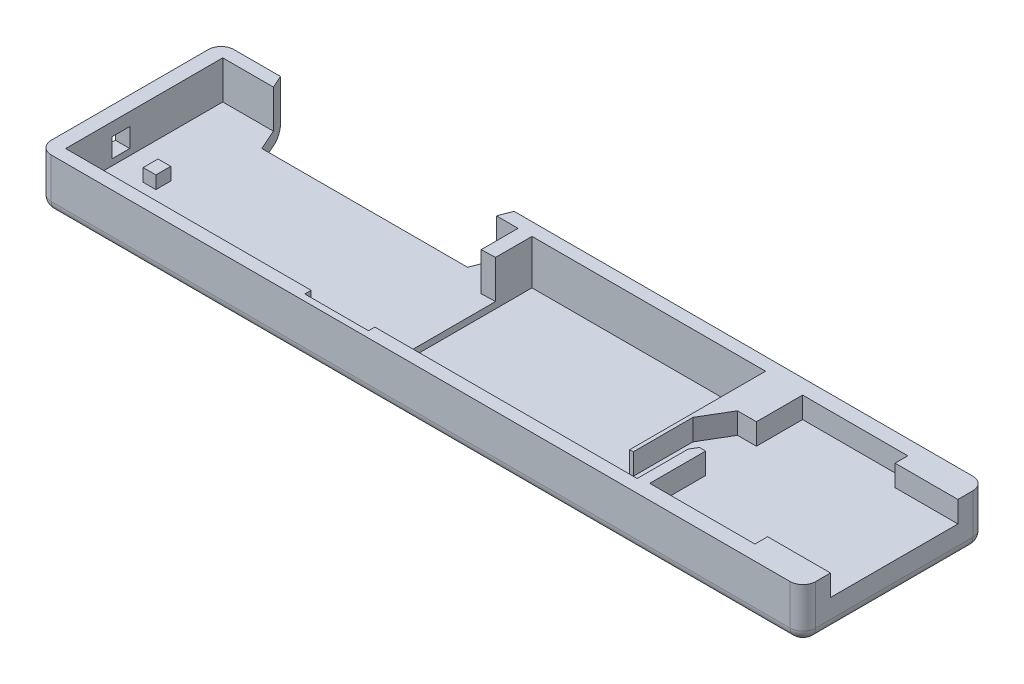
from build123d import *

# Parameters (mm, degrees)
SKETCH_3_W           = 180
SKETCH_3_H           = 43
EXTRUDE_1_DEPTH      = 12
CUT_EXTRUDE_1_DEPTH  = 52
CUT_EXTRUDE_2_DEPTH  = 5
CUT_EXTRUDE_3_DEPTH  = 5
SKETCH_8_W           = 55
SKETCH_8_H           = 37
CUT_EXTRUDE_4_DEPTH  = 10.5
CUT_EXTRUDE_5_DEPTH  = 5
SKETCH_10_W          = 62.128790526
SKETCH_10_H          = 8.683746703
CUT_EXTRUDE_6_DEPTH  = 8
CUT_EXTRUDE_8_DEPTH  = 9
FILLET_3_R           = 3
FILLET_4_R           = 2.5
SKETCH_12_W          = 15
SKETCH_12_H          = 1.5
CUT_EXTRUDE_9_DEPTH  = 5.5
SKETCH_14_W          = 4.2
SKETCH_14_H          = 4.5
CUT_EXTRUDE_10_DEPTH = 5.5
SKETCH_15_W          = 3
SKETCH_15_H          = 3.5
EXTRUDE_2_DEPTH      = 3


with BuildPart() as part:
    # 草图3 → 凸台-拉伸1 (new body)
    with BuildSketch(Plane(origin=(0, 0, 0), x_dir=(1, 0, 0), z_dir=(0, 1, 0))):
        with Locations((50.068597249, 7.753123643)):
            Rectangle(SKETCH_3_W, SKETCH_3_H)
    extrude(amount=EXTRUDE_1_DEPTH)

    # 草图4 → 切除-拉伸1 (cut)
    with BuildSketch(Plane(origin=(0, 0, 0), x_dir=(1, 0, 0), z_dir=(0, 1, 0))):
        Polygon((-22.469613434, -5.858946979), (26.002261286, -5.858946979), (29.068597249, -13.746876357), (-25.931402751, -13.746876357), align=None)
    extrude(amount=CUT_EXTRUDE_1_DEPTH, mode=Mode.SUBTRACT)

    # 草图5 → 切除-拉伸2 (cut)
    with BuildSketch(Plane(origin=(0, 12, 0), x_dir=(1, 0, 0), z_dir=(0, 1, 0))):
        Polygon((140.068597249, 7.753123643), (140.068597249, 22.753123643), (125.276479966, 22.753123643), (125.276479966, -7.246876357), (140.068597249, -7.246876357), align=None)
    extrude(amount=-CUT_EXTRUDE_2_DEPTH, mode=Mode.SUBTRACT)

    # 草图7 → 切除-拉伸3 (cut)
    with BuildSketch(Plane(origin=(0, 12, 0), x_dir=(1, 0, 0), z_dir=(0, 1, 0))):
        Polygon((125.276479966, 7.753123643), (125.276479966, 25.753123643), (100.500825538, 25.753123643), (100.500825538, -10.246876357), (125.276479966, -10.246876357), align=None)
    extrude(amount=-CUT_EXTRUDE_3_DEPTH, mode=Mode.SUBTRACT)

    # 草图8 → 切除-拉伸4 (cut)
    with BuildSketch(Plane(origin=(0, 12, 0), x_dir=(1, 0, 0), z_dir=(0, 1, 0))):
        with Locations((63.776287419, 7.753123643)):
            Rectangle(SKETCH_8_W, SKETCH_8_H)
    extrude(amount=-CUT_EXTRUDE_4_DEPTH, mode=Mode.SUBTRACT)

    # 草图9 → 切除-拉伸5 (cut)
    with BuildSketch(Plane(origin=(0, 12, 0), x_dir=(1, 0, 0), z_dir=(0, 1, 0))):
        Polygon((91.276287419, 26.253123643), (98.039619719, 26.253123643), (98.039619719, 22.130591531), (98.039619719, 14.279735666), (99.048577369, 12.579380219), (100.500825538, 12.579380219), (100.500825538, 0.629591822), (96.047349228, 0.629591822), (92.132656028, 7.226865659), (92.132656028, 21.255120764), (91.276287419, 21.255120764), align=None)
    extrude(amount=-CUT_EXTRUDE_5_DEPTH, mode=Mode.SUBTRACT)

    # 草图10 → 切除-拉伸6 (cut)
    with BuildSketch(Plane(origin=(0, 12, 0), x_dir=(1, 0, 0), z_dir=(0, 1, 0))):
        with Locations((1.934159822, -6.405003006)):
            Rectangle(SKETCH_10_W, SKETCH_10_H)
    extrude(amount=-CUT_EXTRUDE_6_DEPTH, mode=Mode.SUBTRACT)

    # 草图11 → 切除-拉伸8 (cut)
    with BuildSketch(Plane(origin=(0, 12, 0), x_dir=(1, 0, 0), z_dir=(0, 1, 0))):
        Polygon((32.998555085, -10.746876357), (-36.5396752, -10.746876357), (-36.5396752, 26.253123643), (36.276287419, 26.253123643), (36.276287419, -2.167243749), (32.998555085, -2.063129654), align=None)
    extrude(amount=-CUT_EXTRUDE_8_DEPTH, mode=Mode.SUBTRACT)

    # 圆角3
    fillet_3_edges = [part.edges().sort_by_distance(p)[0] for p in [
        (-39.931402751, 6, -29.253123643),
        (140.068597249, 6, -29.253123643),
        (140.068597249, 6, 13.746876357),
        (-39.931402751, 6, 13.746876357),
    ]]
    fillet(fillet_3_edges, radius=FILLET_3_R)

    # 圆角4
    fillet_4_edges = [part.edges().sort_by_distance(p)[0] for p in [
        (83.068597249, 0, 13.746876357),
        (50.068597249, 0, -29.253123643),
        (-31.431402751, 0, 13.746876357),
        (-39.931402751, 0, -7.753123643),
        (140.068597249, 0, -7.753123643),
        (-39.052723094, 0, -28.374443987),
        (-39.052723094, 0, 12.8681967),
        (139.189917593, 0, 12.8681967),
        (139.189917593, 0, -28.374443987),
    ]]
    fillet(fillet_4_edges, radius=FILLET_4_R)

    # 草图12 → 切除-拉伸9 (cut)
    with BuildSketch(Plane(origin=(0, 12, 0), x_dir=(1, 0, 0), z_dir=(0, 1, 0))):
        with Locations((28.776287419, 27.003123643)):
            Rectangle(SKETCH_12_W, SKETCH_12_H)
    extrude(amount=-CUT_EXTRUDE_9_DEPTH, mode=Mode.SUBTRACT)

    # 草图14 → 切除-拉伸10 (cut)
    with BuildSketch(Plane(origin=(-36.5396752, 0, 0), x_dir=(0, 0, -1), z_dir=(1, 0, 0))):
        with Locations((13.253123643, 6.7)):
            Rectangle(SKETCH_14_W, SKETCH_14_H)
    extrude(amount=-CUT_EXTRUDE_10_DEPTH, mode=Mode.SUBTRACT)

    # 草图15 → 凸台-拉伸2 (add)
    with BuildSketch(Plane(origin=(0, 3, 0), x_dir=(1, 0, 0), z_dir=(0, 1, 0))):
        with Locations((-28.0396752, 13.253123643)):
            Rectangle(SKETCH_15_W, SKETCH_15_H)
    extrude(amount=EXTRUDE_2_DEPTH)


with BuildPart() as body_2:
    # 镜向3: mirrored copy
    add(part.part.mirror(Plane(origin=(0, 0, -39.253123643), x_dir=(1, 0, 0), z_dir=(0, 0, -1))))


solid = body_2.part
